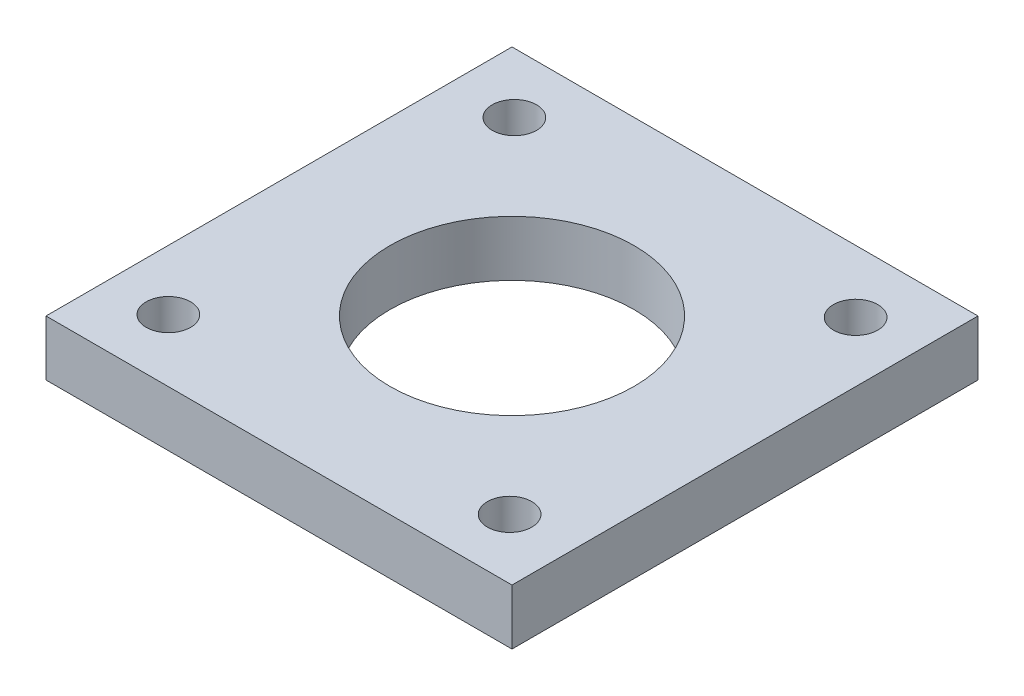
from build123d import *

# Parameters (mm, degrees)
SKETCH1_W           = 42
SKETCH1_H           = 42
SKETCH1_R           = 11
SKETCH1_R_2         = 2
BOSS_EXTRUDE1_DEPTH = 5


with BuildPart() as part:
    # Sketch1 → Boss-Extrude1 (new body)
    with BuildSketch(Plane(origin=(0, 0, 0), x_dir=(1, 0, 0), z_dir=(0, 1, 0))):
        Rectangle(SKETCH1_W, SKETCH1_H)
        with Locations(Location((0, 0, 0), (0, 0, 270))):
            Circle(SKETCH1_R, mode=Mode.SUBTRACT)
        with Locations(Location((-15.592519129, -15.378015061, 0), (0, 0, 270))):
            Circle(SKETCH1_R_2, mode=Mode.SUBTRACT)
        with Locations(Location((-15.378015061, 15.592519129, 0), (0, 0, 270))):
            Circle(SKETCH1_R_2, mode=Mode.SUBTRACT)
        with Locations(Location((15.592519129, 15.378015061, 0), (0, 0, 270))):
            Circle(SKETCH1_R_2, mode=Mode.SUBTRACT)
        with Locations(Location((15.378015061, -15.592519129, 0), (0, 0, 270))):
            Circle(SKETCH1_R_2, mode=Mode.SUBTRACT)
    extrude(amount=BOSS_EXTRUDE1_DEPTH)


solid = part.part
